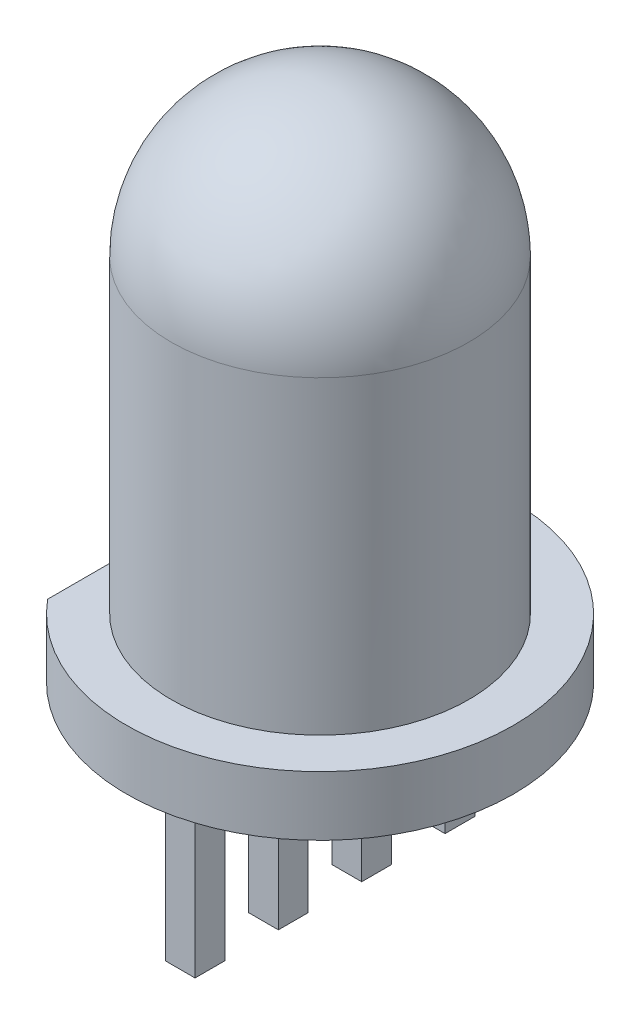
from build123d import *

# Parameters (mm, degrees)
CUT_EXTRUDE_2_REACH = 10.967
SKETCH_5_W          = 0.5
SKETCH_5_H          = 0.5
EXTRUDE_1_DEPTH     = 3


with BuildPart() as part:
    # Эскиз1 → Повернуть1 (revolve)
    with BuildSketch(Plane(origin=(0, 0, 0), x_dir=(0, 0, -1), z_dir=(1, 0, 0)), mode=Mode.PRIVATE) as revolve_1_sk:
        with BuildLine():
            Line((-2.5, 1), (0, 1))
            Line((0, 1), (0, 8.7))
            ThreePointArc((0, 8.7), (-1.767766953, 7.967766953), (-2.5, 6.2))
            Line((-2.5, 6.2), (-2.5, 1))
        make_face()
        Polygon((-3.25, 1), (-3.25, 0), (0, 0), (0, 1), (-2.5, 1), align=None)
    revolve(revolve_1_sk.sketch.rotate(Axis((0, -2.603301624, 0), (0, 1, 0)), 180), axis=Axis((0, -2.603301624, 0), (0, 1, 0)))

    # Эскиз4 → Вырез-Вытянуть2 (cut, up to next)
    with BuildSketch(Plane(origin=(0, 1, 0), x_dir=(1, 0, 0), z_dir=(0, 1, 0)), mode=Mode.PRIVATE) as cut_extrude_2_sk1:
        with BuildLine():
            Line((-2.5, 2.076655966), (-2.5, -2.076655966))
            ThreePointArc((-2.5, -2.076655966), (-3.25, 0), (-2.5, 2.076655966))
        make_face()
    cut_extrude_2_tool1 = extrude(cut_extrude_2_sk1.sketch, amount=-CUT_EXTRUDE_2_REACH, mode=Mode.PRIVATE) & part.part
    add(cut_extrude_2_tool1.solids().sort_by_distance((-2.80318, 1, 0))[0], mode=Mode.SUBTRACT)

    # Эскиз5 → Бобышка-Вытянуть1 (add)
    with BuildSketch(Plane.XZ):
        with Locations((0, 0.7)):
            Rectangle(SKETCH_5_W, SKETCH_5_H)
        with Locations((0, 2.1)):
            Rectangle(SKETCH_5_W, SKETCH_5_H)
        with Locations((0, -0.7)):
            Rectangle(SKETCH_5_W, SKETCH_5_H)
        with Locations((0, -2.1)):
            Rectangle(SKETCH_5_W, SKETCH_5_H)
    extrude(amount=EXTRUDE_1_DEPTH)


solid = part.part
